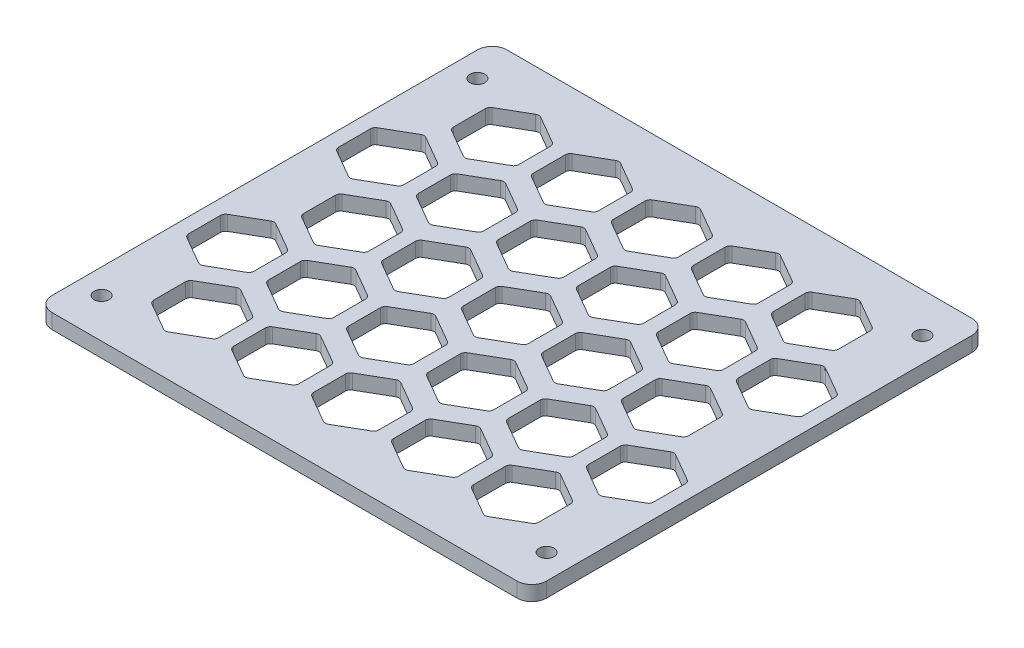
from build123d import *

# Parameters (mm, degrees)
SKETCH_1_W          = 100
SKETCH_1_H          = 92
SKETCH_1_R          = 1.5
EXTRUDE_1_DEPTH     = 3
FILLET_1_R          = 3
CUT_EXTRUDE_1_DEPTH = 10
FILLET_2_R          = 1


with BuildPart() as part:
    # 草图1 → 凸台-拉伸1 (new body)
    with BuildSketch(Plane(origin=(0, 0, 0), x_dir=(1, 0, 0), z_dir=(0, 1, 0))):
        Rectangle(SKETCH_1_W, SKETCH_1_H)
        with Locations(Location((-45, 38, 0), (0, 0, 270))):
            Circle(SKETCH_1_R, mode=Mode.SUBTRACT)
        with Locations(Location((45, 38, 0), (0, 0, 270))):
            Circle(SKETCH_1_R, mode=Mode.SUBTRACT)
        with Locations(Location((45, -38, 0), (0, 0, 270))):
            Circle(SKETCH_1_R, mode=Mode.SUBTRACT)
        with Locations(Location((-45, -38, 0), (0, 0, 270))):
            Circle(SKETCH_1_R, mode=Mode.SUBTRACT)
    extrude(amount=EXTRUDE_1_DEPTH)

    # 圆角1
    fillet_1_edges = [part.edges().sort_by_distance(p)[0] for p in [
        (50, 1.5, 46),
        (-50, 1.5, 46),
        (-50, 1.5, -46),
        (50, 1.5, -46),
    ]]
    fillet(fillet_1_edges, radius=FILLET_1_R)

    # 草图2 → 切除-拉伸1 (cut)
    with BuildSketch(Plane(origin=(0, 3, 0), x_dir=(1, 0, 0), z_dir=(0, 1, 0))):
        Polygon((-32.333333333, 22.709110588), (-25.75, 26.50999986), (-25.75, 34.111778405), (-32.333333333, 37.912667677), (-38.916666667, 34.111778405), (-38.916666667, 26.50999986), align=None)
        Polygon((-16.166666667, 37.912667677), (-22.75, 34.111778405), (-22.75, 26.50999986), (-16.166666667, 22.709110588), (-9.583333333, 26.50999986), (-9.583333333, 34.111778405), align=None)
        Polygon((0, 37.912667677), (-6.583333333, 34.111778405), (-6.583333333, 26.50999986), (0, 22.709110588), (6.583333333, 26.50999986), (6.583333333, 34.111778405), align=None)
        Polygon((-40.416666667, 22.757223111), (-47, 18.956333838), (-47, 11.354555294), (-40.416666667, 7.553666022), (-33.833333333, 11.354555294), (-33.833333333, 18.956333838), align=None)
        Polygon((-24.25, 22.757223111), (-30.833333333, 18.956333838), (-30.833333333, 11.354555294), (-24.25, 7.553666022), (-17.666666667, 11.354555294), (-17.666666667, 18.956333838), align=None)
        Polygon((-8.083333333, 22.757223111), (-14.666666667, 18.956333838), (-14.666666667, 11.354555294), (-8.083333333, 7.553666022), (-1.5, 11.354555294), (-1.5, 18.956333838), align=None)
        Polygon((6.583333333, -3.800889272), (0, -7.601778544), (-6.583333333, -3.800889272), (-6.583333333, 3.800889272), (0, 7.601778544), (6.583333333, 3.800889272), align=None)
        Polygon((-9.583333333, -3.800889272), (-16.166666667, -7.601778544), (-22.75, -3.800889272), (-22.75, 3.800889272), (-16.166666667, 7.601778544), (-9.583333333, 3.800889272), align=None)
        Polygon((-38.916666667, 3.800889272), (-32.333333333, 7.601778544), (-25.75, 3.800889272), (-25.75, -3.800889272), (-32.333333333, -7.601778544), (-38.916666667, -3.800889272), align=None)
        Polygon((9.583333333, 3.800889272), (9.583333333, -3.800889272), (16.166666667, -7.601778544), (22.75, -3.800889272), (22.75, 3.800889272), (16.166666667, 7.601778544), align=None)
        Polygon((38.916666667, -3.800889272), (38.916666667, 3.800889272), (32.333333333, 7.601778544), (25.75, 3.800889272), (25.75, -3.800889272), (32.333333333, -7.601778544), align=None)
        Polygon((33.833333333, 18.956333838), (40.416666667, 22.757223111), (47, 18.956333838), (47, 11.354555294), (40.416666667, 7.553666022), (33.833333333, 11.354555294), align=None)
        Polygon((1.5, 18.956333838), (8.083333333, 22.757223111), (14.666666667, 18.956333838), (14.666666667, 11.354555294), (8.083333333, 7.553666022), (1.5, 11.354555294), align=None)
        Polygon((17.666666667, 18.956333838), (24.25, 22.757223111), (30.833333333, 18.956333838), (30.833333333, 11.354555294), (24.25, 7.553666022), (17.666666667, 11.354555294), align=None)
        Polygon((9.583333333, 34.111778405), (16.166666667, 37.912667677), (22.75, 34.111778405), (22.75, 26.50999986), (16.166666667, 22.709110588), (9.583333333, 26.50999986), align=None)
        Polygon((38.916666667, 26.50999986), (32.333333333, 22.709110588), (25.75, 26.50999986), (25.75, 34.111778405), (32.333333333, 37.912667677), (38.916666667, 34.111778405), align=None)
        Polygon((32.333333333, -22.709110588), (25.75, -26.50999986), (25.75, -34.111778405), (32.333333333, -37.912667677), (38.916666667, -34.111778405), (38.916666667, -26.50999986), align=None)
        Polygon((16.166666667, -37.912667677), (22.75, -34.111778405), (22.75, -26.50999986), (16.166666667, -22.709110588), (9.583333333, -26.50999986), (9.583333333, -34.111778405), align=None)
        Polygon((24.25, -22.757223111), (30.833333333, -18.956333838), (30.833333333, -11.354555294), (24.25, -7.553666022), (17.666666667, -11.354555294), (17.666666667, -18.956333838), align=None)
        Polygon((8.083333333, -22.757223111), (14.666666667, -18.956333838), (14.666666667, -11.354555294), (8.083333333, -7.553666022), (1.5, -11.354555294), (1.5, -18.956333838), align=None)
        Polygon((40.416666667, -22.757223111), (47, -18.956333838), (47, -11.354555294), (40.416666667, -7.553666022), (33.833333333, -11.354555294), (33.833333333, -18.956333838), align=None)
        Polygon((-1.5, -18.956333838), (-8.083333333, -22.757223111), (-14.666666667, -18.956333838), (-14.666666667, -11.354555294), (-8.083333333, -7.553666022), (-1.5, -11.354555294), align=None)
        Polygon((-17.666666667, -18.956333838), (-24.25, -22.757223111), (-30.833333333, -18.956333838), (-30.833333333, -11.354555294), (-24.25, -7.553666022), (-17.666666667, -11.354555294), align=None)
        Polygon((-33.833333333, -18.956333838), (-40.416666667, -22.757223111), (-47, -18.956333838), (-47, -11.354555294), (-40.416666667, -7.553666022), (-33.833333333, -11.354555294), align=None)
        Polygon((6.583333333, -34.111778405), (0, -37.912667677), (-6.583333333, -34.111778405), (-6.583333333, -26.50999986), (0, -22.709110588), (6.583333333, -26.50999986), align=None)
        Polygon((-9.583333333, -34.111778405), (-16.166666667, -37.912667677), (-22.75, -34.111778405), (-22.75, -26.50999986), (-16.166666667, -22.709110588), (-9.583333333, -26.50999986), align=None)
        Polygon((-38.916666667, -26.50999986), (-32.333333333, -22.709110588), (-25.75, -26.50999986), (-25.75, -34.111778405), (-32.333333333, -37.912667677), (-38.916666667, -34.111778405), align=None)
    extrude(amount=-CUT_EXTRUDE_1_DEPTH, mode=Mode.SUBTRACT)

    # 圆角2
    fillet_2_edges = [part.edges().sort_by_distance(p)[0] for p in [
        (1.5, 1.5, -11.354555294),
        (1.5, 1.5, -18.956333838),
        (8.083333333, 1.5, -22.757223111),
        (14.666666667, 1.5, -18.956333838),
        (14.666666667, 1.5, -11.354555294),
        (8.083333333, 1.5, -7.553666022),
        (33.833333333, 1.5, -11.354555294),
        (33.833333333, 1.5, -18.956333838),
        (40.416666667, 1.5, -22.757223111),
        (47, 1.5, -18.956333838),
        (47, 1.5, -11.354555294),
        (40.416666667, 1.5, -7.553666022),
        (38.916666667, 1.5, 3.800889272),
        (32.333333333, 1.5, 7.601778544),
        (25.75, 1.5, 3.800889272),
        (25.75, 1.5, -3.800889272),
        (32.333333333, 1.5, -7.601778544),
        (38.916666667, 1.5, -3.800889272),
        (9.583333333, 1.5, -3.800889272),
        (16.166666667, 1.5, -7.601778544),
        (22.75, 1.5, -3.800889272),
        (22.75, 1.5, 3.800889272),
        (16.166666667, 1.5, 7.601778544),
        (9.583333333, 1.5, 3.800889272),
        (32.333333333, 1.5, 22.709110588),
        (38.916666667, 1.5, 26.50999986),
        (38.916666667, 1.5, 34.111778405),
        (32.333333333, 1.5, 37.912667677),
        (25.75, 1.5, 34.111778405),
        (25.75, 1.5, 26.50999986),
        (38.916666667, 1.5, -34.111778405),
        (38.916666667, 1.5, -26.50999986),
        (32.333333333, 1.5, -22.709110588),
        (25.75, 1.5, -26.50999986),
        (25.75, 1.5, -34.111778405),
        (32.333333333, 1.5, -37.912667677),
        (17.666666667, 1.5, -11.354555294),
        (17.666666667, 1.5, -18.956333838),
        (24.25, 1.5, -22.757223111),
        (30.833333333, 1.5, -18.956333838),
        (30.833333333, 1.5, -11.354555294),
        (24.25, 1.5, -7.553666022),
        (9.583333333, 1.5, -26.50999986),
        (9.583333333, 1.5, -34.111778405),
        (16.166666667, 1.5, -37.912667677),
        (22.75, 1.5, -34.111778405),
        (22.75, 1.5, -26.50999986),
        (16.166666667, 1.5, -22.709110588),
        (0, 1.5, -37.912667677),
        (6.583333333, 1.5, -34.111778405),
        (6.583333333, 1.5, -26.50999986),
        (0, 1.5, -22.709110588),
        (-6.583333333, 1.5, -26.50999986),
        (-6.583333333, 1.5, -34.111778405),
        (-16.166666667, 1.5, -37.912667677),
        (-9.583333333, 1.5, -34.111778405),
        (-9.583333333, 1.5, -26.50999986),
        (-16.166666667, 1.5, -22.709110588),
        (-22.75, 1.5, -26.50999986),
        (-22.75, 1.5, -34.111778405),
        (-40.416666667, 1.5, -22.757223111),
        (-33.833333333, 1.5, -18.956333838),
        (-33.833333333, 1.5, -11.354555294),
        (-40.416666667, 1.5, -7.553666022),
        (-47, 1.5, -11.354555294),
        (-47, 1.5, -18.956333838),
        (-24.25, 1.5, -22.757223111),
        (-17.666666667, 1.5, -18.956333838),
        (-17.666666667, 1.5, -11.354555294),
        (-24.25, 1.5, -7.553666022),
        (-30.833333333, 1.5, -11.354555294),
        (-30.833333333, 1.5, -18.956333838),
        (-38.916666667, 1.5, 3.800889272),
        (-38.916666667, 1.5, -3.800889272),
        (-32.333333333, 1.5, -7.601778544),
        (-25.75, 1.5, -3.800889272),
        (-25.75, 1.5, 3.800889272),
        (-32.333333333, 1.5, 7.601778544),
        (-9.583333333, 1.5, -3.800889272),
        (-9.583333333, 1.5, 3.800889272),
        (-16.166666667, 1.5, 7.601778544),
        (-22.75, 1.5, 3.800889272),
        (-22.75, 1.5, -3.800889272),
        (-16.166666667, 1.5, -7.601778544),
        (-8.083333333, 1.5, -22.757223111),
        (-1.5, 1.5, -18.956333838),
        (-1.5, 1.5, -11.354555294),
        (-8.083333333, 1.5, -7.553666022),
        (-14.666666667, 1.5, -11.354555294),
        (-14.666666667, 1.5, -18.956333838),
        (6.583333333, 1.5, -3.800889272),
        (6.583333333, 1.5, 3.800889272),
        (0, 1.5, 7.601778544),
        (-6.583333333, 1.5, 3.800889272),
        (-6.583333333, 1.5, -3.800889272),
        (0, 1.5, -7.601778544),
        (-38.916666667, 1.5, 34.111778405),
        (-38.916666667, 1.5, 26.50999986),
        (-32.333333333, 1.5, 22.709110588),
        (-25.75, 1.5, 26.50999986),
        (-25.75, 1.5, 34.111778405),
        (-32.333333333, 1.5, 37.912667677),
        (-9.583333333, 1.5, 26.50999986),
        (-9.583333333, 1.5, 34.111778405),
        (-16.166666667, 1.5, 37.912667677),
        (-22.75, 1.5, 34.111778405),
        (-22.75, 1.5, 26.50999986),
        (-16.166666667, 1.5, 22.709110588),
        (40.416666667, 1.5, 22.757223111),
        (33.833333333, 1.5, 18.956333838),
        (33.833333333, 1.5, 11.354555294),
        (40.416666667, 1.5, 7.553666022),
        (47, 1.5, 11.354555294),
        (47, 1.5, 18.956333838),
        (8.083333333, 1.5, 22.757223111),
        (1.5, 1.5, 18.956333838),
        (1.5, 1.5, 11.354555294),
        (8.083333333, 1.5, 7.553666022),
        (14.666666667, 1.5, 11.354555294),
        (14.666666667, 1.5, 18.956333838),
        (16.166666667, 1.5, 37.912667677),
        (9.583333333, 1.5, 34.111778405),
        (9.583333333, 1.5, 26.50999986),
        (16.166666667, 1.5, 22.709110588),
        (22.75, 1.5, 26.50999986),
        (22.75, 1.5, 34.111778405),
        (24.25, 1.5, 22.757223111),
        (17.666666667, 1.5, 18.956333838),
        (17.666666667, 1.5, 11.354555294),
        (24.25, 1.5, 7.553666022),
        (30.833333333, 1.5, 11.354555294),
        (30.833333333, 1.5, 18.956333838),
        (6.583333333, 1.5, 26.50999986),
        (6.583333333, 1.5, 34.111778405),
        (0, 1.5, 37.912667677),
        (-6.583333333, 1.5, 34.111778405),
        (-6.583333333, 1.5, 26.50999986),
        (0, 1.5, 22.709110588),
        (-33.833333333, 1.5, 11.354555294),
        (-33.833333333, 1.5, 18.956333838),
        (-40.416666667, 1.5, 22.757223111),
        (-47, 1.5, 18.956333838),
        (-47, 1.5, 11.354555294),
        (-40.416666667, 1.5, 7.553666022),
        (-17.666666667, 1.5, 11.354555294),
        (-17.666666667, 1.5, 18.956333838),
        (-24.25, 1.5, 22.757223111),
        (-30.833333333, 1.5, 18.956333838),
        (-30.833333333, 1.5, 11.354555294),
        (-24.25, 1.5, 7.553666022),
        (-1.5, 1.5, 11.354555294),
        (-1.5, 1.5, 18.956333838),
        (-8.083333333, 1.5, 22.757223111),
        (-14.666666667, 1.5, 18.956333838),
        (-14.666666667, 1.5, 11.354555294),
        (-8.083333333, 1.5, 7.553666022),
        (-32.333333333, 1.5, -22.709110588),
        (-38.916666667, 1.5, -26.50999986),
        (-38.916666667, 1.5, -34.111778405),
        (-32.333333333, 1.5, -37.912667677),
        (-25.75, 1.5, -34.111778405),
        (-25.75, 1.5, -26.50999986),
    ]]
    fillet(fillet_2_edges, radius=FILLET_2_R)


solid = part.part
